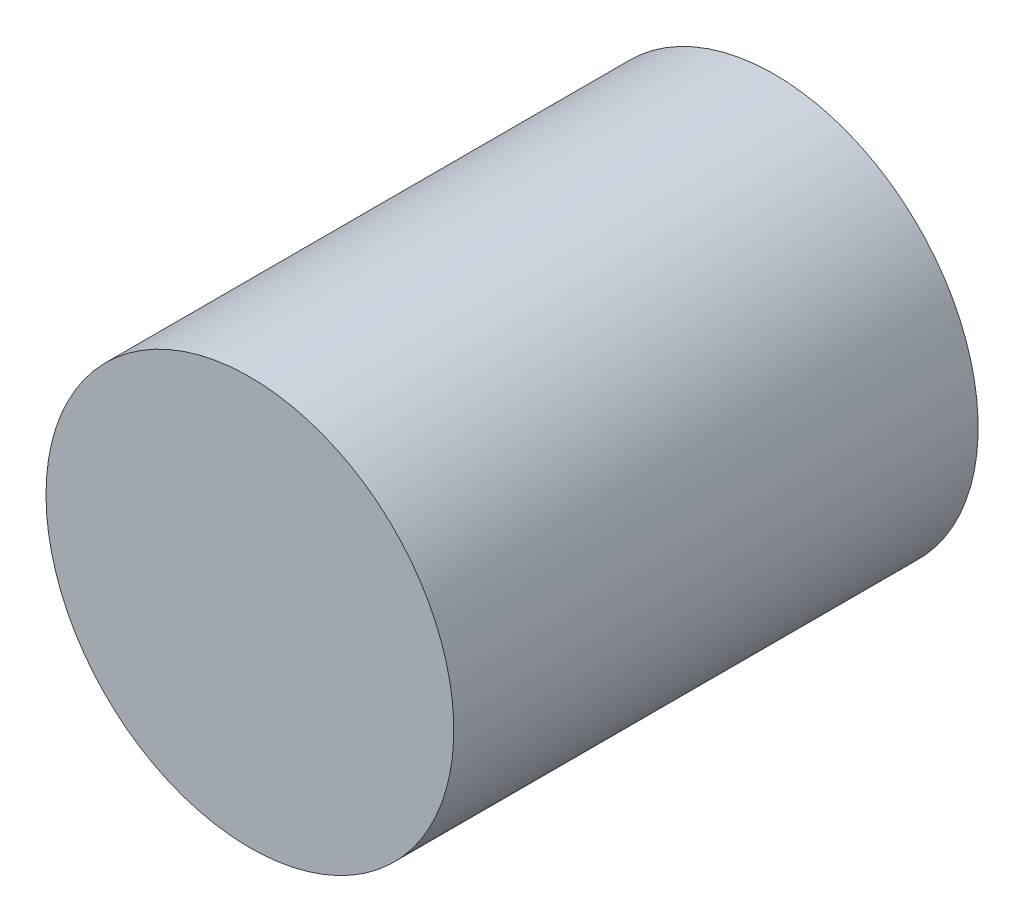
from build123d import *

# Parameters (mm, degrees)
SKETCH_1_R                        = 35
SOLID_OBS_01_ELBOW_CYLINDER_DEPTH = 90


with BuildPart() as part:
    # 草图1 → solid_obs_01_elbow_cylinder (new body)
    with BuildSketch(Plane.XY):
        with Locations(Location((0, 0, 0), (0, 0, 180))):
            Circle(SKETCH_1_R)
    extrude(amount=SOLID_OBS_01_ELBOW_CYLINDER_DEPTH)


solid = part.part
